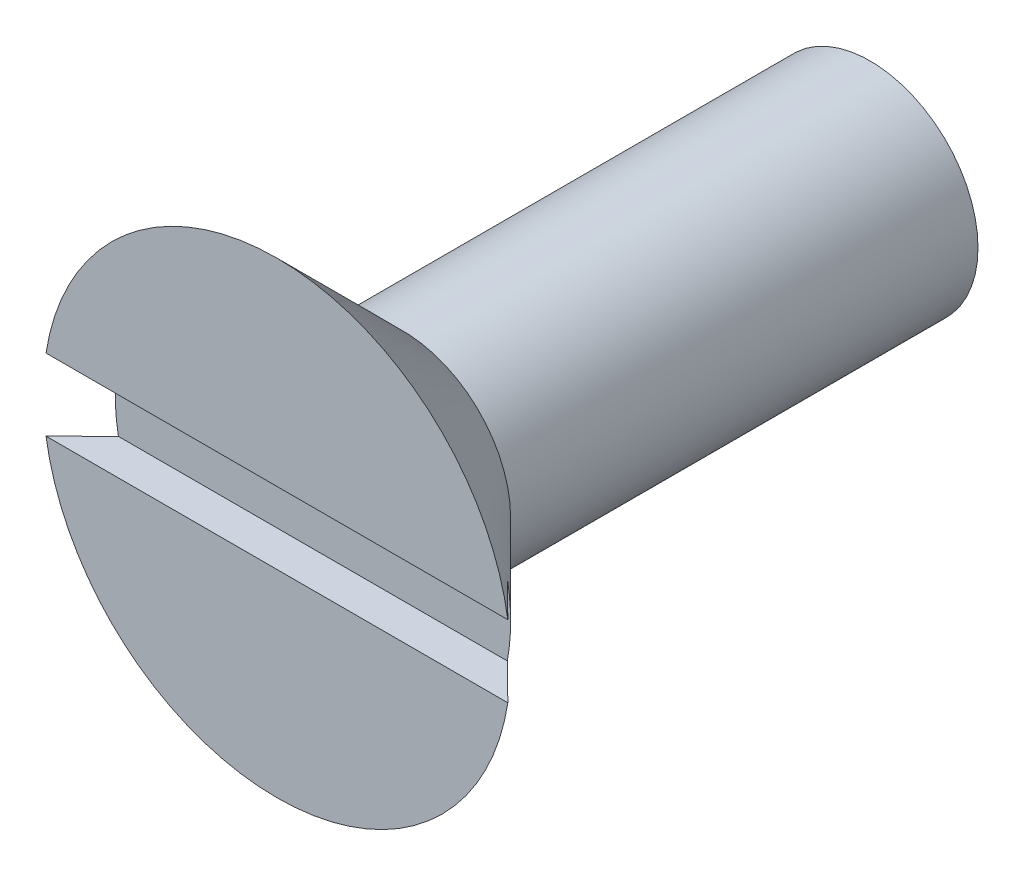
from build123d import *

# Parameters (mm, degrees)
CUT_EXTRUDE1_DEPTH      = 14.725722055
CUT_EXTRUDE1_DEPTH_BACK = 14.725722055
SKETCH2_W               = 2
SKETCH2_H               = 2


with BuildPart() as part:
    # Sketch1 → Revolve1 (revolve)
    with BuildSketch(Plane(origin=(0, 0, 0), x_dir=(0, 0, -1), z_dir=(1, 0, 0)), mode=Mode.PRIVATE) as revolve1_sk:
        Polygon((10.192911554, 0), (8.460860746, 3), (-4.539139254, 3), (-8.039139254, 6.5), (-8.039139254, 0), align=None)
    revolve(revolve1_sk.sketch.rotate(Axis((0, 0, 15.249403341), (0, 0, -1)), 90), axis=Axis((0, 0, 15.249403341), (0, 0, -1)))

    # Sketch2 → Cut-Extrude1 (cut, two sides: drawn at the far end of the back side and taken through both)
    with BuildSketch(Plane(origin=(0, 0, 0), x_dir=(0, 0, -1), z_dir=(1, 0, 0)).offset(-CUT_EXTRUDE1_DEPTH_BACK)):
        with Locations((-8.039139254, 0)):
            Rectangle(SKETCH2_W, SKETCH2_H)
    extrude(amount=CUT_EXTRUDE1_DEPTH + CUT_EXTRUDE1_DEPTH_BACK, mode=Mode.SUBTRACT)


solid = part.part
